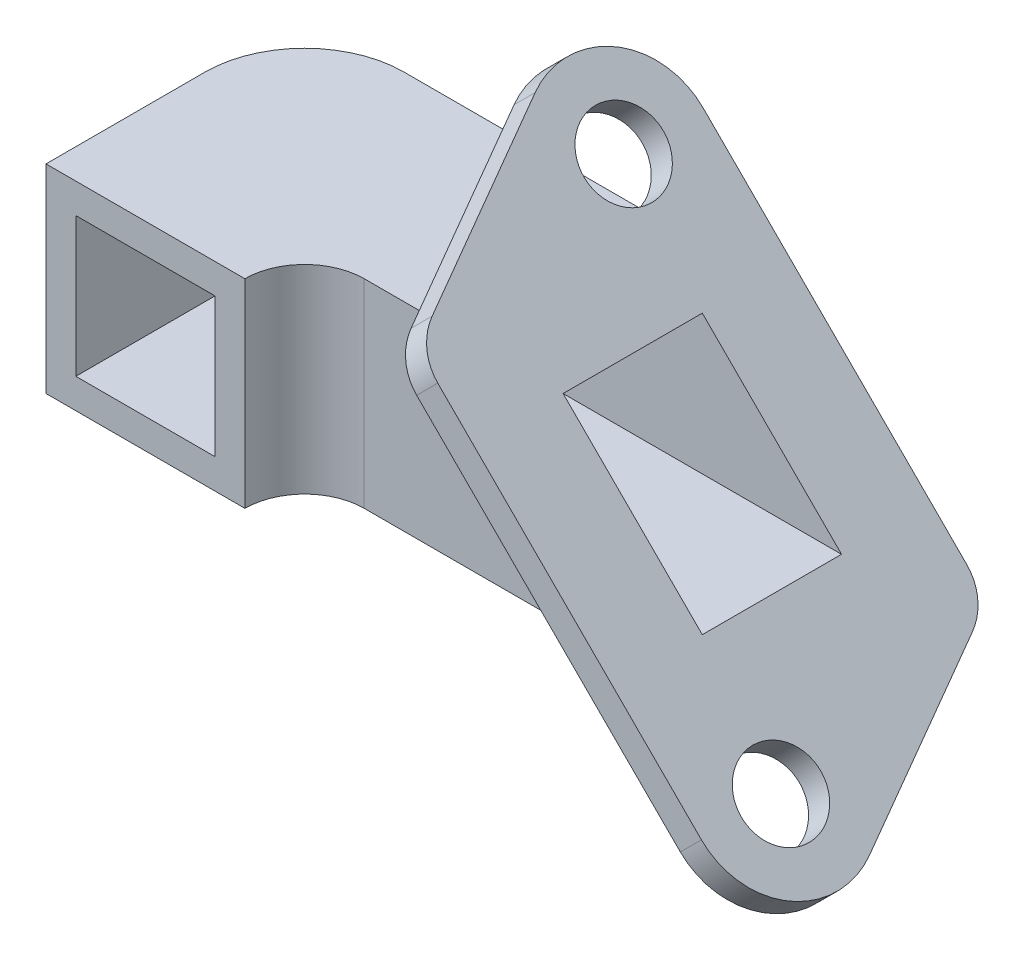
from build123d import *

# Parameters (mm, degrees)
EXTRUDE_1_DEPTH          = 20
SHELL_1_T                = -6
CUT_EXTRUDE_2_DEPTH      = 110.544511501
CUT_EXTRUDE_2_DEPTH_BACK = 110.544511501
SKETCH_4_R               = 8
SKETCH_4_W               = 28
SKETCH_4_H               = 48.08326112
EXTRUDE_5_DEPTH          = 6


with BuildPart() as part:
    # 草圖1 → 伸長1 (new, symmetric)
    with BuildSketch(Plane(origin=(0, 0, 0), x_dir=(1, 0, 0), z_dir=(0, 1, 0))):
        with BuildLine():
            Line((56.455835634, -20), (-48, -20))
            ThreePointArc((-48, -20), (-56.485281374, -23.514718626), (-60, -32))
            Line((-60, -32), (-100, -32))
            Line((-100, -32), (-100, 0))
            ThreePointArc((-100, 0), (-94.142135624, 14.142135624), (-80, 20))
            Line((-80, 20), (56.455835634, 20))
            Line((56.455835634, 20), (56.455835634, -20))
        make_face()
    extrude(amount=EXTRUDE_1_DEPTH, both=True)

    # 薄殼1
    shell_1_openings = [part.faces().sort_by_distance(p)[0] for p in [
        (-80, 0, 32),
        (56.455835634, 0, 0),
    ]]
    offset(amount=SHELL_1_T, openings=shell_1_openings, kind=Kind.INTERSECTION)

    # 草圖3 → 伸長2 (cut, two sides: drawn at the far end of the back side and taken through both)
    with BuildSketch(Plane.XY.offset(20).offset(-CUT_EXTRUDE_2_DEPTH_BACK)):
        Polygon((-238.812297792, 238.812297792), (-31.748125619, 31.748125619), (31.647752007, -31.647752007), (238.711924181, -238.711924181), (652.840268527, 175.416420166), (175.316046555, 652.940642138), align=None)
    extrude(amount=CUT_EXTRUDE_2_DEPTH + CUT_EXTRUDE_2_DEPTH_BACK, mode=Mode.SUBTRACT)

    # 草圖4 → 伸長5 (add)
    with BuildSketch(Plane(origin=(0, 0, 0), x_dir=(0, 0, -1), z_dir=(0.7071067811865488, 0.7071067811865464, 0))):
        with BuildLine():
            Line((32, -29.988893001), (32, 45))
            ThreePointArc((32, 45), (24, 58.856406461), (8, 58.856406461))
            Line((8, 58.856406461), (-27, 38.649147039))
            ThreePointArc((-27, 38.649147039), (-30.660254038, 34.988893001), (-32, 29.988893001))
            Line((-32, 29.988893001), (-32, -45))
            ThreePointArc((-32, -45), (-24, -58.856406461), (-8, -58.856406461))
            Line((-8, -58.856406461), (27, -38.649147039))
            ThreePointArc((27, -38.649147039), (30.660254038, -34.988893001), (32, -29.988893001))
        make_face()
        with Locations(Location((16, 45, 0), (0, 0, 90))):
            Circle(SKETCH_4_R, mode=Mode.SUBTRACT)
        with Locations(Location((-16, -45, 0), (0, 0, 90))):
            Circle(SKETCH_4_R, mode=Mode.SUBTRACT)
        with Locations((0, 4.242640687)):
            Rectangle(SKETCH_4_W, SKETCH_4_H, mode=Mode.SUBTRACT)
    extrude(amount=-EXTRUDE_5_DEPTH)


solid = part.part
